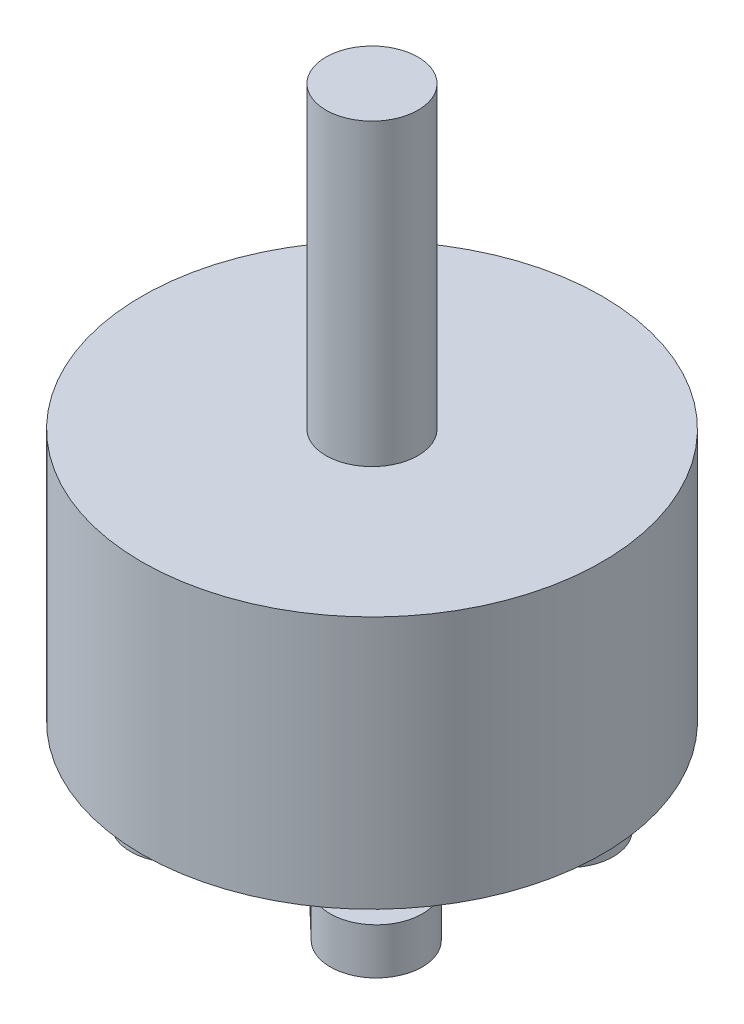
from build123d import *

# Parameters (mm, degrees)
SKETCH2_R           = 10
BOSS_EXTRUDE2_DEPTH = 30
CUT_EXTRUDE5_START  = -13
SKETCH8_R           = 10
SKETCH8_R_2         = 4
CUT_EXTRUDE5_DEPTH  = 13
CUT_EXTRUDE6_START  = -13
SKETCH9_R           = 4
SKETCH9_R_2         = 2
CUT_EXTRUDE6_DEPTH  = 13
SKETCH10_R          = 10
SKETCH10_R_2        = 1
CUT_EXTRUDE7_DEPTH  = 1
SKETCH11_R          = 10
SKETCH11_R_2        = 2
CUT_EXTRUDE8_DEPTH  = 2
SKETCH12_R          = 10
CUT_EXTRUDE9_DEPTH  = 4
SKETCH13_R          = 10
SKETCH13_R_2        = 4
CUT_EXTRUDE10_DEPTH = 2
SKETCH14_R          = 1
CUT_EXTRUDE11_DEPTH = 2


with BuildPart() as part:
    # Sketch2 → Boss-Extrude2 (new body)
    with BuildSketch(Plane(origin=(0, 0, 0), x_dir=(1, 0, 0), z_dir=(0, 1, 0))):
        with Locations(Location((0, 0, 0), (0, 0, 270))):
            Circle(SKETCH2_R)
    extrude(amount=BOSS_EXTRUDE2_DEPTH)

    # Sketch8 → Cut-Extrude5 (cut)
    with BuildSketch(Plane(origin=(0, 30, 0), x_dir=(1, 0, 0), z_dir=(0, 1, 0)).offset(CUT_EXTRUDE5_START)):
        with Locations(Location((0, 0, 0), (0, 0, 270))):
            Circle(SKETCH8_R)
        with Locations(Location((0, 0, 0), (0, 0, 270))):
            Circle(SKETCH8_R_2, mode=Mode.SUBTRACT)
    extrude(amount=CUT_EXTRUDE5_DEPTH, mode=Mode.SUBTRACT)

    # Sketch9 → Cut-Extrude6 (cut)
    with BuildSketch(Plane(origin=(0, 30, 0), x_dir=(1, 0, 0), z_dir=(0, 1, 0)).offset(CUT_EXTRUDE6_START)):
        Circle(SKETCH9_R)
        with Locations(Location((0, 0, 0), (0, 0, 270))):
            Circle(SKETCH9_R_2, mode=Mode.SUBTRACT)
    extrude(amount=CUT_EXTRUDE6_DEPTH, mode=Mode.SUBTRACT)

    # Sketch10 → Cut-Extrude7 (cut)
    with BuildSketch(Plane.XZ):
        with Locations(Location((0, 0, 0), (0, 0, 270))):
            Circle(SKETCH10_R)
        with Locations(Location((0, 0, 0), (0, 0, 270))):
            Circle(SKETCH10_R_2, mode=Mode.SUBTRACT)
    extrude(amount=-CUT_EXTRUDE7_DEPTH, mode=Mode.SUBTRACT)

    # Sketch11 → Cut-Extrude8 (cut)
    with BuildSketch(Plane(origin=(0, 0, 0), x_dir=(-1, 0, 0), z_dir=(0, -1, 0))):
        with Locations(Location((0, 0, 0), (0, 0, 90))):
            Circle(SKETCH11_R)
        with Locations(Location((0, 0, 0), (0, 0, 270))):
            Circle(SKETCH11_R_2, mode=Mode.SUBTRACT)
    extrude(amount=-CUT_EXTRUDE8_DEPTH, mode=Mode.SUBTRACT)

    # Sketch12 → Cut-Extrude9 (cut)
    with BuildSketch(Plane(origin=(0, 0, 0), x_dir=(-1, 0, 0), z_dir=(0, -1, 0))):
        with Locations(Location((0, 0, 0), (0, 0, 90))):
            Circle(SKETCH12_R)
        with BuildLine():
            Line((1.442076294, -4.148689545), (-1.442076294, -4.148689545))
            Line((-1.442076294, -4.148689545), (-2.95165941, -5.593541519))
            ThreePointArc((-2.95165941, -5.593541519), (-5.779407899, -5.53158606), (-5.717452439, -2.70383757))
            Line((-5.717452439, -2.70383757), (-4.334555924, -1.380239856))
            Line((-4.334555924, -1.380239856), (-4.334555924, 1.380239856))
            Line((-4.334555924, 1.380239856), (-5.717452439, 2.70383757))
            ThreePointArc((-5.717452439, 2.70383757), (-5.779407899, 5.53158606), (-2.95165941, 5.593541519))
            Line((-2.95165941, 5.593541519), (-1.442076294, 4.148689545))
            Line((-1.442076294, 4.148689545), (1.442076294, 4.148689545))
            Line((1.442076294, 4.148689545), (2.95165941, 5.593541519))
            ThreePointArc((2.95165941, 5.593541519), (5.779407899, 5.53158606), (5.717452439, 2.70383757))
            Line((5.717452439, 2.70383757), (4.334555924, 1.380239856))
            Line((4.334555924, 1.380239856), (4.334555924, -1.380239856))
            Line((4.334555924, -1.380239856), (5.717452439, -2.70383757))
            ThreePointArc((5.717452439, -2.70383757), (5.779407899, -5.53158606), (2.95165941, -5.593541519))
            Line((2.95165941, -5.593541519), (1.442076294, -4.148689545))
        make_face(mode=Mode.SUBTRACT)
    extrude(amount=-CUT_EXTRUDE9_DEPTH, mode=Mode.SUBTRACT)

    # Sketch13 → Cut-Extrude10 (cut)
    with BuildSketch(Plane.XZ.offset(-4)):
        with Locations(Location((0, 0, 0), (0, 0, 270))):
            Circle(SKETCH13_R)
        with Locations(Location((0, 0, 0), (0, 0, 270))):
            Circle(SKETCH13_R_2, mode=Mode.SUBTRACT)
    extrude(amount=-CUT_EXTRUDE10_DEPTH, mode=Mode.SUBTRACT)

    # Sketch14 → Cut-Extrude11 (cut)
    with BuildSketch(Plane.XZ.offset(-2)):
        with Locations(Location((-4.287533824, 4.199553123, 0), (0, 0, 270))):
            Circle(SKETCH14_R)
        with Locations(Location((4.390527215, 4.092485492, 0), (0, 0, 270))):
            Circle(SKETCH14_R)
        with Locations(Location((4.354750155, -4.127894387, 0), (0, 0, 270))):
            Circle(SKETCH14_R)
        with Locations(Location((-4.322800784, -4.16107677, 0), (0, 0, 270))):
            Circle(SKETCH14_R)
    extrude(amount=-CUT_EXTRUDE11_DEPTH, mode=Mode.SUBTRACT)


solid = part.part
